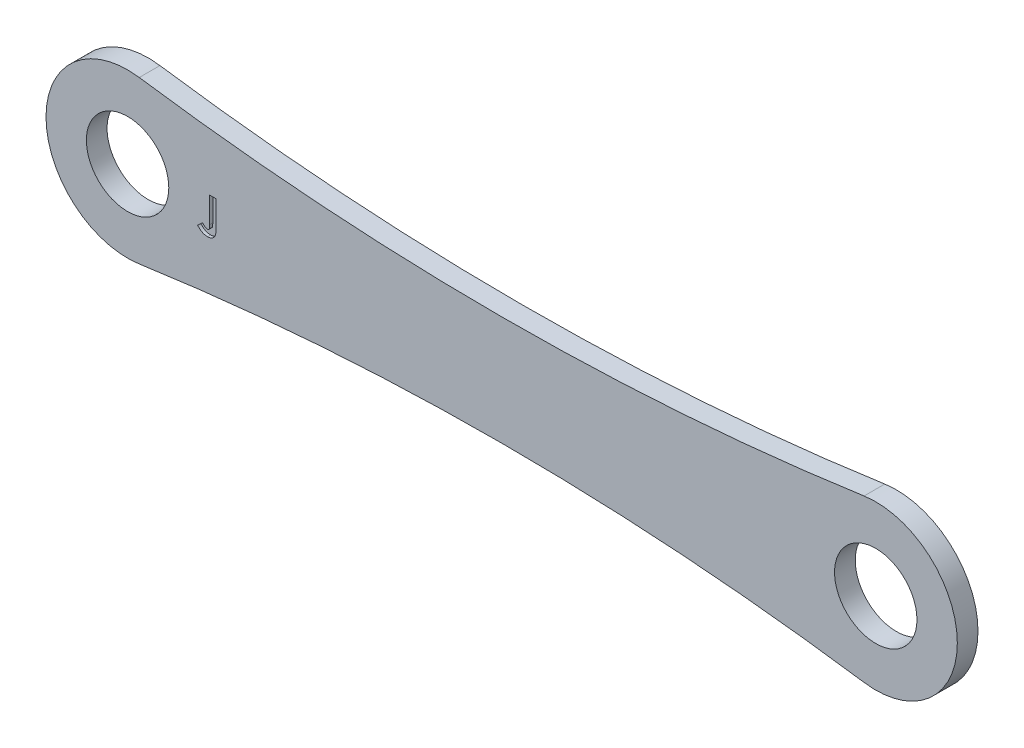
from build123d import *

# Parameters (mm, degrees)
ESQUISSE1_R             = 3.985
BOSS_EXTRU_1_DEPTH      = 2
ENL_V_MAT_EXTRU_1_DEPTH = 0.3


with BuildPart() as part:
    # Esquisse1 → Boss.-Extru.1 (new body)
    with BuildSketch(Plane(origin=(0, 0, 0), x_dir=(0, 1, 0), z_dir=(0, 0, 1))):
        with BuildLine():
            ThreePointArc((-7.808836578, 1.128791965), (0, -7.89), (7.808836578, 1.128791965))
            ThreePointArc((7.808836578, 1.128791965), (5.288552874, 36.18), (7.808836578, 71.231208035))
            ThreePointArc((7.808836578, 71.231208035), (0, 80.25), (-7.808836578, 71.231208035))
            ThreePointArc((-7.808836578, 71.231208035), (-5.288552874, 36.18), (-7.808836578, 1.128791965))
        make_face()
        with Locations(Location((0, 0, 0), (0, 0, 270))):
            Circle(ESQUISSE1_R, mode=Mode.SUBTRACT)
        with Locations(Location((0, 72.36, 0), (0, 0, 270))):
            Circle(ESQUISSE1_R, mode=Mode.SUBTRACT)
    extrude(amount=BOSS_EXTRU_1_DEPTH)

    # Esquisse2 → Enlèv. mat.-Extru.1 (cut)
    with BuildSketch(Plane.XY.offset(2)):
        with BuildLine():
            Line((-64.419013619, 1.363972656), (-63.790808491, 1.363972656))
            Line((-63.790808491, 1.363972656), (-63.790808491, -0.959544972))
            add(Edge.make_bspline(
                [(-63.790808491, -0.959544972), (-63.791038809, -1.003953677), (-63.791482588, -1.089520485), (-63.795925603, -1.212705101), (-63.801933342, -1.32564701), (-63.810585066, -1.428165243), (-63.823435245, -1.520254841), (-63.837977746, -1.60214556), (-63.854022161, -1.674171081), (-63.881125115, -1.754778845), (-63.923201666, -1.844042774), (-63.986696382, -1.940460503), (-64.065767627, -2.02423108), (-64.156831583, -2.096995508), (-64.260655531, -2.154611171), (-64.374847611, -2.196255927), (-64.499042779, -2.221134792), (-64.58506355, -2.224195282), (-64.629350157, -2.225770934)],
                knots=[0, 0, 0, 0, 1.22248561, 2.355488409, 3.392943897, 4.335991845, 5.186735882, 5.951517034, 6.625683685, 7.215700098, 8.28923535, 9.333114649, 10.380102123, 11.447198135, 12.530158036, 13.633358744, 14.781567393, 16, 16, 16, 16], degree=3))
            add(Edge.make_bspline(
                [(-64.629350157, -2.225770934), (-64.675492772, -2.224342411), (-64.766504027, -2.221524808), (-64.899981406, -2.197526059), (-65.028269852, -2.159048845), (-65.150705669, -2.10341541), (-65.268966265, -2.033727017), (-65.380905318, -1.947285348), (-65.488859962, -1.846771339), (-65.552856134, -1.769639411), (-65.585680285, -1.730077825)],
                knots=[0, 0, 0, 0, 0.990984786, 1.954608977, 2.90473533, 3.862451285, 4.837525908, 5.848096122, 6.896271184, 8, 8, 8, 8], degree=3))
            Line((-65.585680285, -1.730077825), (-65.110319708, -1.290474459))
            add(Edge.make_bspline(
                [(-65.110319708, -1.290474459), (-65.085430365, -1.318617278), (-65.038855713, -1.371280057), (-64.968669084, -1.439953614), (-64.905356964, -1.495124891), (-64.845674591, -1.53492043), (-64.789353767, -1.562971842), (-64.73518271, -1.583178063), (-64.681472832, -1.594615932), (-64.645990448, -1.596597398), (-64.628649035, -1.597565805)],
                knots=[0, 0, 0, 0, 1.529509877, 2.862124173, 3.996688592, 4.944357383, 5.774364335, 6.554177287, 7.293378699, 8, 8, 8, 8], degree=3))
            add(Edge.make_bspline(
                [(-64.628649035, -1.597565805), (-64.611864478, -1.596690518), (-64.579593293, -1.595007627), (-64.535219176, -1.576300168), (-64.497808939, -1.54692867), (-64.473180247, -1.513162323), (-64.457485253, -1.478644025), (-64.447678724, -1.445276783), (-64.438372312, -1.405278504), (-64.430916222, -1.358669235), (-64.425282386, -1.30484102), (-64.422474327, -1.244447332), (-64.419059366, -1.177161813), (-64.41902941, -1.130157038), (-64.419013619, -1.105378305)],
                knots=[0, 0, 0, 0, 1.003927327, 1.930222208, 2.840933547, 3.835773585, 4.407906147, 5.114514582, 5.922289074, 6.876303333, 7.950072246, 9.174518422, 10.510537432, 12, 12, 12, 12], degree=3))
            Line((-64.419013619, -1.105378305), (-64.419013619, 1.363972656))
        make_face()
    extrude(amount=-ENL_V_MAT_EXTRU_1_DEPTH, mode=Mode.SUBTRACT)


solid = part.part
